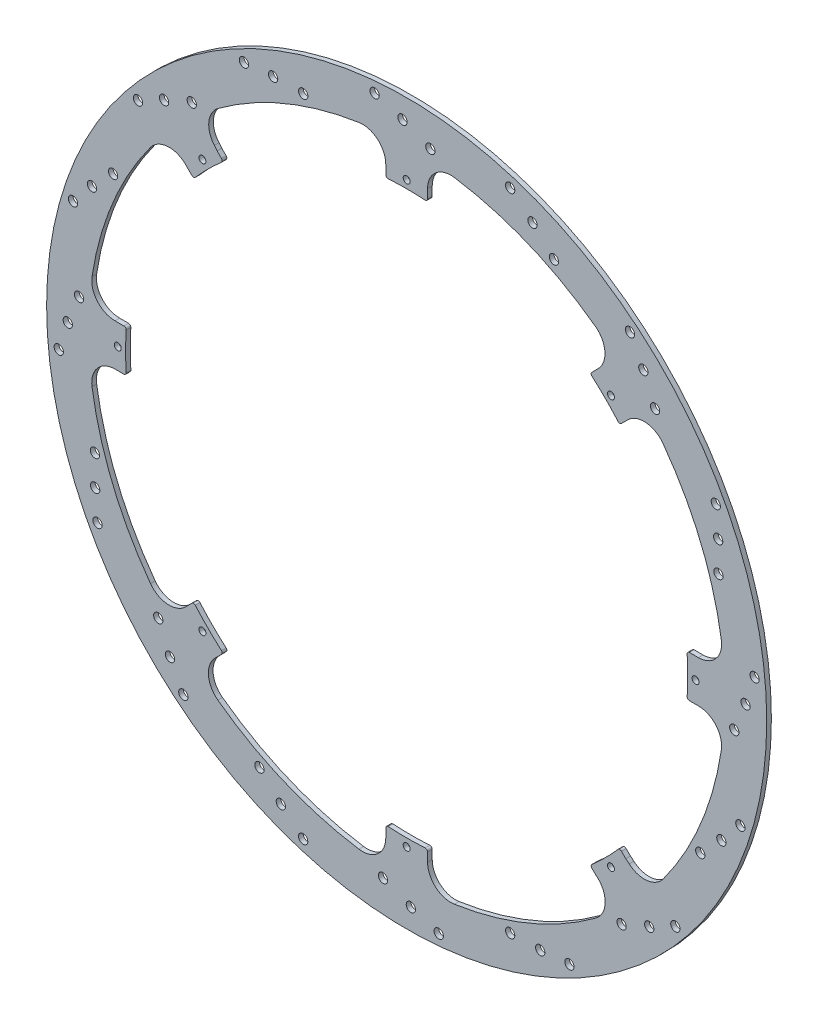
from build123d import *

# Parameters (mm, degrees)
IZIM1_R                     = 155
IZIM1_R_2                   = 124
Y_KSEKLIK_EKSTR_ZYON1_DEPTH = 2
KES_EKSTR_ZYON1_START       = -52
IZIM2_R                     = 124
KES_EKSTR_ZYON1_DEPTH       = 52
RADYUS1_R                   = 10
IZIM4_R                     = 2
KES_EKSTR_ZYON3_DEPTH       = 52
IZIM5_R                     = 124.709021001
KES_EKSTR_ZYON4_DEPTH       = 10
Y_KSEKLIK_EKSTR_ZYON3_DEPTH = 2
IZIM7_R                     = 1.5
KES_EKSTR_ZYON5_DEPTH       = 36
RADYUS2_R                   = 1


with BuildPart() as part:
    # Çizim1 → Yükseklik-Ekstrüzyon1 (new body)
    with BuildSketch(Plane.XY):
        Circle(IZIM1_R)
        Circle(IZIM1_R_2, mode=Mode.SUBTRACT)
    extrude(amount=Y_KSEKLIK_EKSTR_ZYON1_DEPTH)

    # Çizim2 → Kes-Ekstrüzyon1 (cut)
    with BuildSketch(Plane.XY.offset(2).offset(KES_EKSTR_ZYON1_START)):
        with BuildLine():
            Line((-89.586978875, 103.649279862), (-81.086024675, 93.813946737))
            ThreePointArc((-81.086024675, 93.813946737), (-47.452745613, 114.561062031), (-9, 123.672955815))
            Line((-9, 123.672955815), (-9, 136.704059925))
            ThreePointArc((-9, 136.704059925), (-51.990409906, 126.751715088), (-89.586978875, 103.649279862))
        make_face()
        with BuildLine():
            ThreePointArc((9, 123.672955815), (47.452745613, 114.561062031), (81.086024675, 93.813946737))
            Line((81.086024675, 93.813946737), (90.300406758, 103.028328819))
            ThreePointArc((90.300406758, 103.028328819), (52.427630234, 126.571495954), (9, 136.704059925))
            Line((9, 136.704059925), (9, 123.672955815))
        make_face()
        with BuildLine():
            ThreePointArc((93.813946737, 81.086024675), (114.561062031, 47.452745613), (123.672955815, 9))
            Line((123.672955815, 9), (136.704059925, 9))
            ThreePointArc((136.704059925, 9), (126.571495954, 52.427630234), (103.028328819, 90.300406758))
            Line((103.028328819, 90.300406758), (93.813946737, 81.086024675))
        make_face()
        with BuildLine():
            ThreePointArc((123.672955815, -9), (114.561062031, -47.452745613), (93.813946737, -81.086024675))
            Line((93.813946737, -81.086024675), (103.649279862, -89.586978875))
            ThreePointArc((103.649279862, -89.586978875), (126.751715088, -51.990409906), (136.704059925, -9))
            Line((136.704059925, -9), (123.672955815, -9))
        make_face()
        with BuildLine():
            ThreePointArc((81.086024675, -93.813946737), (47.452745613, -114.561062031), (9, -123.672955815))
            Line((9, -123.672955815), (9, -136.704059925))
            ThreePointArc((9, -136.704059925), (52.868223391, -126.388096573), (91.01600833, -102.396710043))
            Line((91.01600833, -102.396710043), (81.086024675, -93.813946737))
        make_face()
        with BuildLine():
            Line((-9, -136.704059925), (-9, -123.672955815))
            ThreePointArc((-9, -123.672955815), (-47.452745613, -114.561062031), (-81.086024675, -93.813946737))
            Line((-81.086024675, -93.813946737), (-90.300406758, -103.028328819))
            ThreePointArc((-90.300406758, -103.028328819), (-52.427630234, -126.571495954), (-9, -136.704059925))
        make_face()
        with BuildLine():
            Line((-103.028328819, -90.300406758), (-93.813946737, -81.086024675))
            ThreePointArc((-93.813946737, -81.086024675), (-114.561062031, -47.452745613), (-123.672955815, -9))
            Line((-123.672955815, -9), (-136.704059925, -9))
            ThreePointArc((-136.704059925, -9), (-126.571495954, -52.427630234), (-103.028328819, -90.300406758))
        make_face()
        with BuildLine():
            Line((-136.704059925, 9), (-123.672955815, 9))
            ThreePointArc((-123.672955815, 9), (-114.561062031, 47.452745613), (-93.813946737, 81.086024675))
            Line((-93.813946737, 81.086024675), (-103.028328819, 90.300406758))
            ThreePointArc((-103.028328819, 90.300406758), (-126.571495954, 52.427630234), (-136.704059925, 9))
        make_face()
        Circle(IZIM2_R)
    extrude(amount=KES_EKSTR_ZYON1_DEPTH, mode=Mode.SUBTRACT)

    # Radyus1
    radyus1_edges = [part.edges().sort_by_distance(p)[0] for p in [
        (-89.586978875, 103.649279862, 1),
        (9, 136.704059925, 1),
        (103.028328819, 90.300406758, 1),
        (136.704059925, -9, 1),
        (91.01600833, -102.396710043, 1),
        (-9, -136.704059925, 1),
        (-103.028328819, -90.300406758, 1),
        (-136.704059925, 9, 1),
        (-9, 136.704059925, 1),
        (90.300406758, 103.028328819, 1),
        (136.704059925, 9, 1),
        (103.649279862, -89.586978875, 1),
        (9, -136.704059925, 1),
        (-90.300406758, -103.028328819, 1),
        (-136.704059925, -9, 1),
        (-103.028328819, 90.300406758, 1),
    ]]
    fillet(radyus1_edges, radius=RADYUS1_R)

    # Çizim4 → Kes-Ekstrüzyon3 (cut)
    with BuildSketch(Plane.XY.offset(2)):
        with Locations((44.561444493, 143.637563619)):
            Circle(IZIM4_R)
        with Locations((54.164430205, 135.463710808)):
            Circle(IZIM4_R)
        with Locations((-13.798309356, 149.756731658)):
            Circle(IZIM4_R)
        with Locations((-1.798309356, 145.879979876)):
            Circle(IZIM4_R)
        with Locations((10.201690644, 141.022545647)):
            Circle(IZIM4_R)
        with Locations((63.392124992, 126.383825554)):
            Circle(IZIM4_R)
        with Locations((96.137122369, 115.650878598)):
            Circle(IZIM4_R)
        with Locations((101.88112627, 104.42431975)):
            Circle(IZIM4_R)
        with Locations((106.931682961, 92.504313693)):
            Circle(IZIM4_R)
        with Locations((133.076794849, 70.057395688)):
            Circle(IZIM4_R)
        with Locations((134.087344414, 57.487272619)):
            Circle(IZIM4_R)
        with Locations((134.191861537, 44.541858626)):
            Circle(IZIM4_R)
        with Locations((149.756731658, 13.798309356)):
            Circle(IZIM4_R)
        with Locations((145.879979876, 1.798309356)):
            Circle(IZIM4_R)
        with Locations((141.022545647, -10.201690644)):
            Circle(IZIM4_R)
        with Locations((143.637563619, -44.561444493)):
            Circle(IZIM4_R)
        with Locations((135.463710808, -54.164430205)):
            Circle(IZIM4_R)
        with Locations((126.383825554, -63.392124992)):
            Circle(IZIM4_R)
        with Locations((115.650878598, -96.137122369)):
            Circle(IZIM4_R)
        with Locations((104.42431975, -101.88112627)):
            Circle(IZIM4_R)
        with Locations((92.504313693, -106.931682961)):
            Circle(IZIM4_R)
        with Locations((70.057395688, -133.076794849)):
            Circle(IZIM4_R)
        with Locations((57.487272619, -134.087344414)):
            Circle(IZIM4_R)
        with Locations((44.541858626, -134.191861537)):
            Circle(IZIM4_R)
        with Locations((13.798309356, -149.756731658)):
            Circle(IZIM4_R)
        with Locations((1.798309356, -145.879979876)):
            Circle(IZIM4_R)
        with Locations((-10.201690644, -141.022545646)):
            Circle(IZIM4_R)
        with Locations((-44.561444493, -143.637563619)):
            Circle(IZIM4_R)
        with Locations((-54.164430205, -135.463710808)):
            Circle(IZIM4_R)
        with Locations((-63.392124992, -126.383825554)):
            Circle(IZIM4_R)
        with Locations((-96.137122369, -115.650878598)):
            Circle(IZIM4_R)
        with Locations((-101.88112627, -104.42431975)):
            Circle(IZIM4_R)
        with Locations((-106.931682961, -92.504313693)):
            Circle(IZIM4_R)
        with Locations((-133.076794849, -70.057395688)):
            Circle(IZIM4_R)
        with Locations((-134.087344414, -57.487272619)):
            Circle(IZIM4_R)
        with Locations((-134.191861537, -44.541858626)):
            Circle(IZIM4_R)
        with Locations((-149.756731658, -13.798309356)):
            Circle(IZIM4_R)
        with Locations((-145.879979876, -1.798309356)):
            Circle(IZIM4_R)
        with Locations((-141.022545646, 10.201690644)):
            Circle(IZIM4_R)
        with Locations((-143.637563619, 44.561444493)):
            Circle(IZIM4_R)
        with Locations((-135.463710808, 54.164430205)):
            Circle(IZIM4_R)
        with Locations((-126.383825554, 63.392124992)):
            Circle(IZIM4_R)
        with Locations((-115.650878598, 96.137122369)):
            Circle(IZIM4_R)
        with Locations((-104.42431975, 101.88112627)):
            Circle(IZIM4_R)
        with Locations((-92.504313693, 106.931682961)):
            Circle(IZIM4_R)
        with Locations((-70.057395688, 133.076794849)):
            Circle(IZIM4_R)
        with Locations((-57.487272619, 134.087344414)):
            Circle(IZIM4_R)
        with Locations((-44.541858626, 134.191861537)):
            Circle(IZIM4_R)
    extrude(amount=-KES_EKSTR_ZYON3_DEPTH, mode=Mode.SUBTRACT)

    # Çizim5 → Kes-Ekstrüzyon4 (cut)
    with BuildSketch(Plane.XY.offset(2)):
        Circle(IZIM5_R)
    extrude(amount=-KES_EKSTR_ZYON4_DEPTH, mode=Mode.SUBTRACT)

    # Çizim6 → Yükseklik-Ekstrüzyon3 (add)
    with BuildSketch(Plane.XY.offset(2)):
        with BuildLine():
            Line((-9, 124.383841069), (-9, 120.664825032))
            ThreePointArc((-9, 120.664825032), (0, 121), (9, 120.664825032))
            Line((9, 120.664825032), (9, 124.383841069))
            ThreePointArc((9, 124.383841069), (0, 124.709021001), (-9, 124.383841069))
        make_face()
        with BuildLine():
            Line((81.588696459, 94.316618521), (78.958955, 91.686877061))
            ThreePointArc((78.958955, 91.686877061), (85.559920524, 85.559920524), (91.686877061, 78.958955))
            Line((91.686877061, 78.958955), (94.316618521, 81.588696459))
            ThreePointArc((94.316618521, 81.588696459), (88.182594425, 88.182594425), (81.588696459, 94.316618521))
        make_face()
        with BuildLine():
            Line((124.383841069, 9), (120.664825032, 9))
            ThreePointArc((120.664825032, 9), (121, 0), (120.664825032, -9))
            Line((120.664825032, -9), (124.383841069, -9))
            ThreePointArc((124.383841069, -9), (124.709021001, 0), (124.383841069, 9))
        make_face()
        with BuildLine():
            Line((94.316618521, -81.588696459), (91.686877061, -78.958955))
            ThreePointArc((91.686877061, -78.958955), (85.559920524, -85.559920524), (78.958955, -91.686877061))
            Line((78.958955, -91.686877061), (81.588696459, -94.316618521))
            ThreePointArc((81.588696459, -94.316618521), (88.182594425, -88.182594425), (94.316618521, -81.588696459))
        make_face()
        with BuildLine():
            Line((9, -124.383841069), (9, -120.664825032))
            ThreePointArc((9, -120.664825032), (0, -121), (-9, -120.664825032))
            Line((-9, -120.664825032), (-9, -124.383841069))
            ThreePointArc((-9, -124.383841069), (0, -124.709021001), (9, -124.383841069))
        make_face()
        with BuildLine():
            Line((-81.588696459, -94.316618521), (-78.958955, -91.686877061))
            ThreePointArc((-78.958955, -91.686877061), (-85.559920524, -85.559920524), (-91.686877061, -78.958955))
            Line((-91.686877061, -78.958955), (-94.316618521, -81.588696459))
            ThreePointArc((-94.316618521, -81.588696459), (-88.182594425, -88.182594425), (-81.588696459, -94.316618521))
        make_face()
        with BuildLine():
            Line((-124.383841069, -9), (-120.664825032, -9))
            ThreePointArc((-120.664825032, -9), (-121, 0), (-120.664825032, 9))
            Line((-120.664825032, 9), (-124.383841069, 9))
            ThreePointArc((-124.383841069, 9), (-124.709021001, 0), (-124.383841069, -9))
        make_face()
        with BuildLine():
            Line((-94.316618521, 81.588696459), (-91.686877061, 78.958955))
            ThreePointArc((-91.686877061, 78.958955), (-85.559920524, 85.559920524), (-78.958955, 91.686877061))
            Line((-78.958955, 91.686877061), (-81.588696459, 94.316618521))
            ThreePointArc((-81.588696459, 94.316618521), (-88.182594425, 88.182594425), (-94.316618521, 81.588696459))
        make_face()
    extrude(amount=-Y_KSEKLIK_EKSTR_ZYON3_DEPTH)

    # Çizim7 → Kes-Ekstrüzyon5 (cut)
    with BuildSketch(Plane.XY.offset(2)):
        with Locations((0, 124.364033251)):
            Circle(IZIM7_R)
        with Locations((87.938651247, 87.938651247)):
            Circle(IZIM7_R)
        with Locations((124.364033251, 0)):
            Circle(IZIM7_R)
        with Locations((87.938651247, -87.938651247)):
            Circle(IZIM7_R)
        with Locations((0, -124.364033251)):
            Circle(IZIM7_R)
        with Locations((-87.938651247, -87.938651247)):
            Circle(IZIM7_R)
        with Locations((-124.364033251, 0)):
            Circle(IZIM7_R)
        with Locations((-87.938651247, 87.938651247)):
            Circle(IZIM7_R)
    extrude(amount=-KES_EKSTR_ZYON5_DEPTH, mode=Mode.SUBTRACT)

    # Radyus2
    radyus2_edges = [part.edges().sort_by_distance(p)[0] for p in [
        (9, 120.664825032, 1),
        (-9, 120.664825032, 1),
        (91.686877061, 78.958955, 1),
        (78.958955, 91.686877061, 1),
        (120.664825032, -9, 1),
        (120.664825032, 9, 1),
        (78.958955, -91.686877061, 1),
        (91.686877061, -78.958955, 1),
        (-9, -120.664825032, 1),
        (9, -120.664825032, 1),
        (-91.686877061, -78.958955, 1),
        (-78.958955, -91.686877061, 1),
        (-120.664825032, 9, 1),
        (-120.664825032, -9, 1),
        (-78.958955, 91.686877061, 1),
        (-91.686877061, 78.958955, 1),
    ]]
    fillet(radyus2_edges, radius=RADYUS2_R)


solid = part.part
